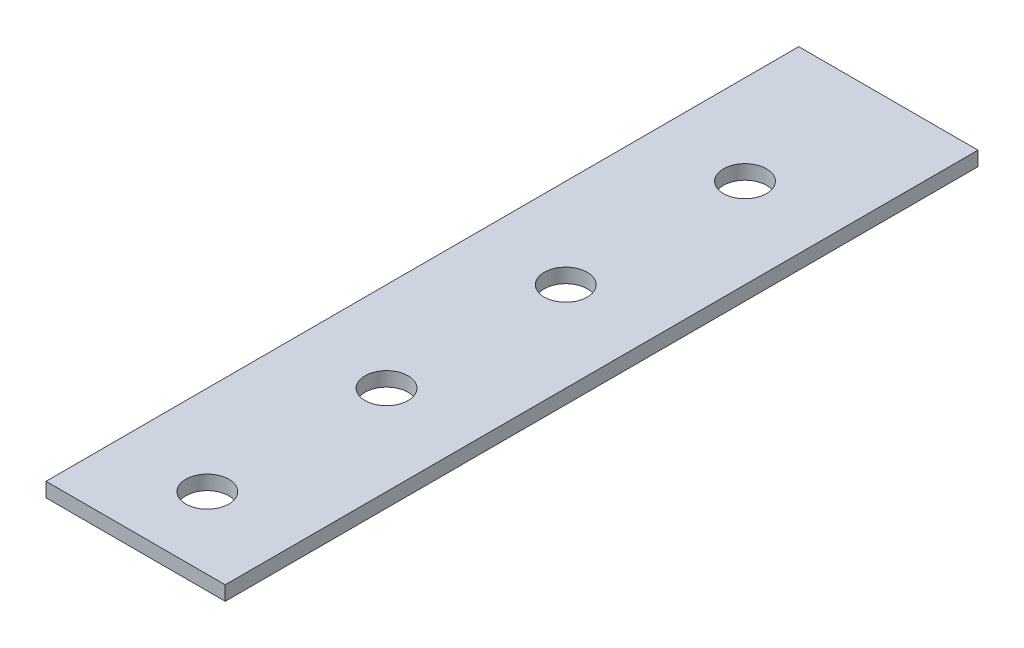
from build123d import *

# Parameters (mm, degrees)
SKETCH1_W           = 25
SKETCH1_H           = 105
BOSS_EXTRUDE1_DEPTH = 2
SKETCH2_R           = 3
CUT_EXTRUDE1_DEPTH  = 55.004629431


with BuildPart() as part:
    # Sketch1 → Boss-Extrude1 (new body)
    with BuildSketch(Plane(origin=(0, 0, 0), x_dir=(1, 0, 0), z_dir=(0, 1, 0))):
        Rectangle(SKETCH1_W, SKETCH1_H)
    extrude(amount=BOSS_EXTRUDE1_DEPTH)

    # Sketch2 → Cut-Extrude1 (cut, through all)
    with BuildSketch(Plane(origin=(0, 2, 0), x_dir=(1, 0, 0), z_dir=(0, 1, 0))):
        with Locations(Location((0, -42.5, 0), (0, 0, 270))):
            Circle(SKETCH2_R)
        with Locations(Location((0, -17.5, 0), (0, 0, 270))):
            Circle(SKETCH2_R)
        with Locations(Location((0, 7.5, 0), (0, 0, 270))):
            Circle(SKETCH2_R)
        with Locations(Location((0, 32.5, 0), (0, 0, 270))):
            Circle(SKETCH2_R)
    extrude(amount=-CUT_EXTRUDE1_DEPTH, mode=Mode.SUBTRACT)


solid = part.part
